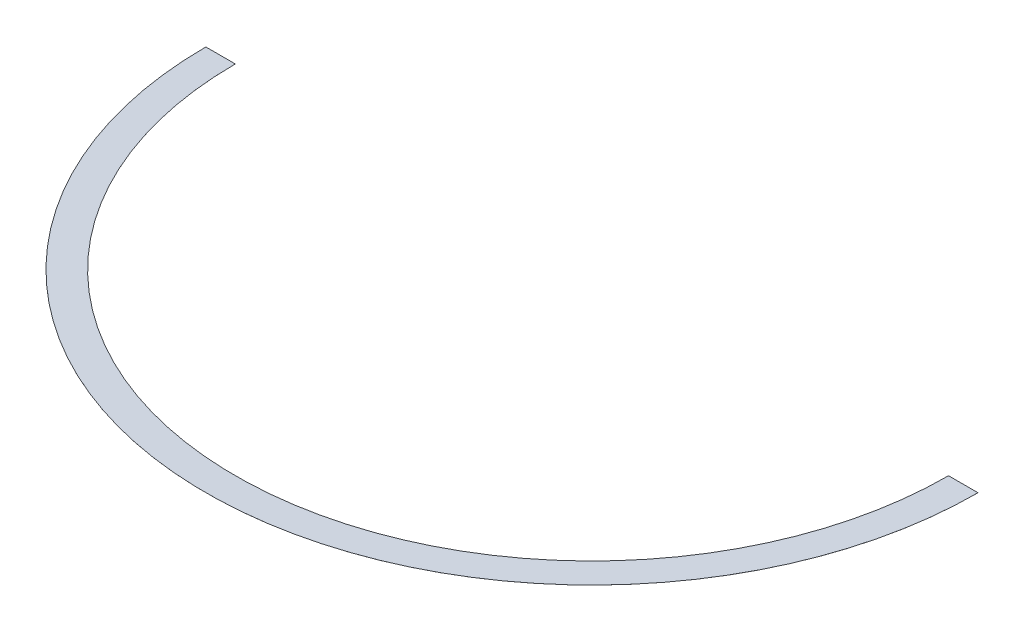
from build123d import *

# Parameters (mm, degrees)
RESSALTO_EXTRUS_O8_DEPTH = 0.01


with BuildPart() as part:
    # Esboço1 → Ressalto-extrusão8 (new body)
    with BuildSketch(Plane(origin=(0, 0, 0), x_dir=(1, 0, 0), z_dir=(0, 1, 0))):
        with BuildLine():
            Line((637.155889964, 1114.760527722), (656.090281198, 1114.760527722))
            ThreePointArc((656.090281198, 1114.760527722), (408.004300022, 866.674546546), (159.918318846, 1114.760527722))
            Line((159.918318846, 1114.760527722), (178.852710089, 1114.760527722))
            ThreePointArc((178.852710089, 1114.760527722), (408.004300026, 885.608937784), (637.155889964, 1114.760527722))
        make_face()
    extrude(amount=RESSALTO_EXTRUS_O8_DEPTH)


solid = part.part
